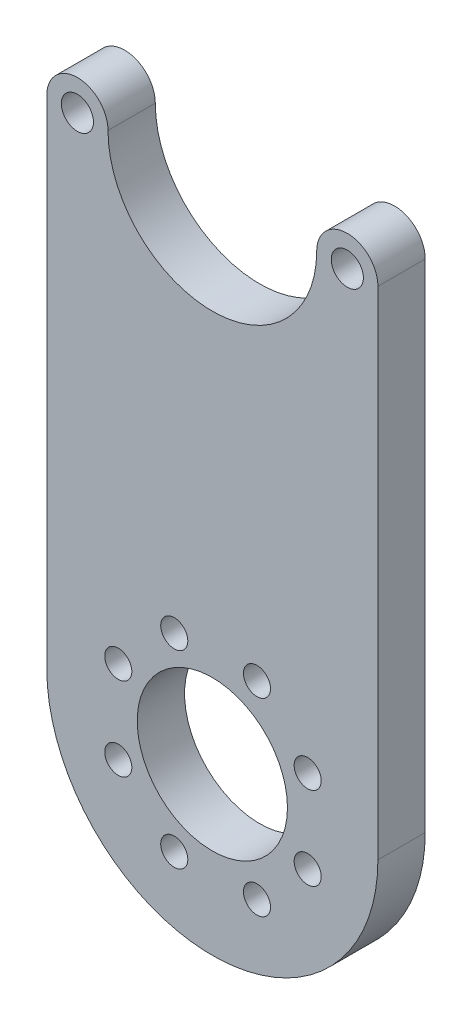
from build123d import *

# Parameters (mm, degrees)
SKETCH_1_R      = 7.94
SKETCH_1_R_2    = 1.697891057
SKETCH_1_R_3    = 1.431269813
EXTRUDE_1_DEPTH = 5


with BuildPart() as part:
    # 草图1 → 凸台-拉伸1 (new body)
    with BuildSketch(Plane.XY):
        with BuildLine():
            Line((-22.842936614, 35.573770492), (-22.842936614, -16.926229508))
            ThreePointArc((-22.842936614, -16.926229508), (-5.342936614, -34.426229508), (12.157063386, -16.926229508))
            Line((12.157063386, -16.926229508), (12.157063386, 35.573770492))
            ThreePointArc((12.157063386, 35.573770492), (8.922010957, 38.80882292), (5.686958528, 35.573770492))
            ThreePointArc((5.686958528, 35.573770492), (-5.342936614, 24.543875349), (-16.372831757, 35.573770492))
            ThreePointArc((-16.372831757, 35.573770492), (-19.607884186, 38.80882292), (-22.842936614, 35.573770492))
        make_face()
        with Locations((-5.342936614, -16.926229508)):
            Circle(SKETCH_1_R, mode=Mode.SUBTRACT)
        with Locations((-19.607884186, 35.573770492)):
            Circle(SKETCH_1_R_2, mode=Mode.SUBTRACT)
        with Locations((8.922010957, 35.573770492)):
            Circle(SKETCH_1_R_2, mode=Mode.SUBTRACT)
        with Locations((-9.369105652, -6.944867305)):
            Circle(SKETCH_1_R_3, mode=Mode.SUBTRACT)
        with Locations((-15.286101655, -12.698452236)):
            Circle(SKETCH_1_R_3, mode=Mode.SUBTRACT)
        with Locations((-0.625126274, -26.940078994)):
            Circle(SKETCH_1_R_3, mode=Mode.SUBTRACT)
        with Locations((-15.286101655, -21.484473196)):
            Circle(SKETCH_1_R_3, mode=Mode.SUBTRACT)
        with Locations((-9.369105652, -26.940078994)):
            Circle(SKETCH_1_R_3, mode=Mode.SUBTRACT)
        with Locations((-0.625126274, -6.944867305)):
            Circle(SKETCH_1_R_3, mode=Mode.SUBTRACT)
        with Locations((4.733813833, -12.698452236)):
            Circle(SKETCH_1_R_3, mode=Mode.SUBTRACT)
        with Locations((4.733813833, -21.484473196)):
            Circle(SKETCH_1_R_3, mode=Mode.SUBTRACT)
    extrude(amount=EXTRUDE_1_DEPTH)


solid = part.part
